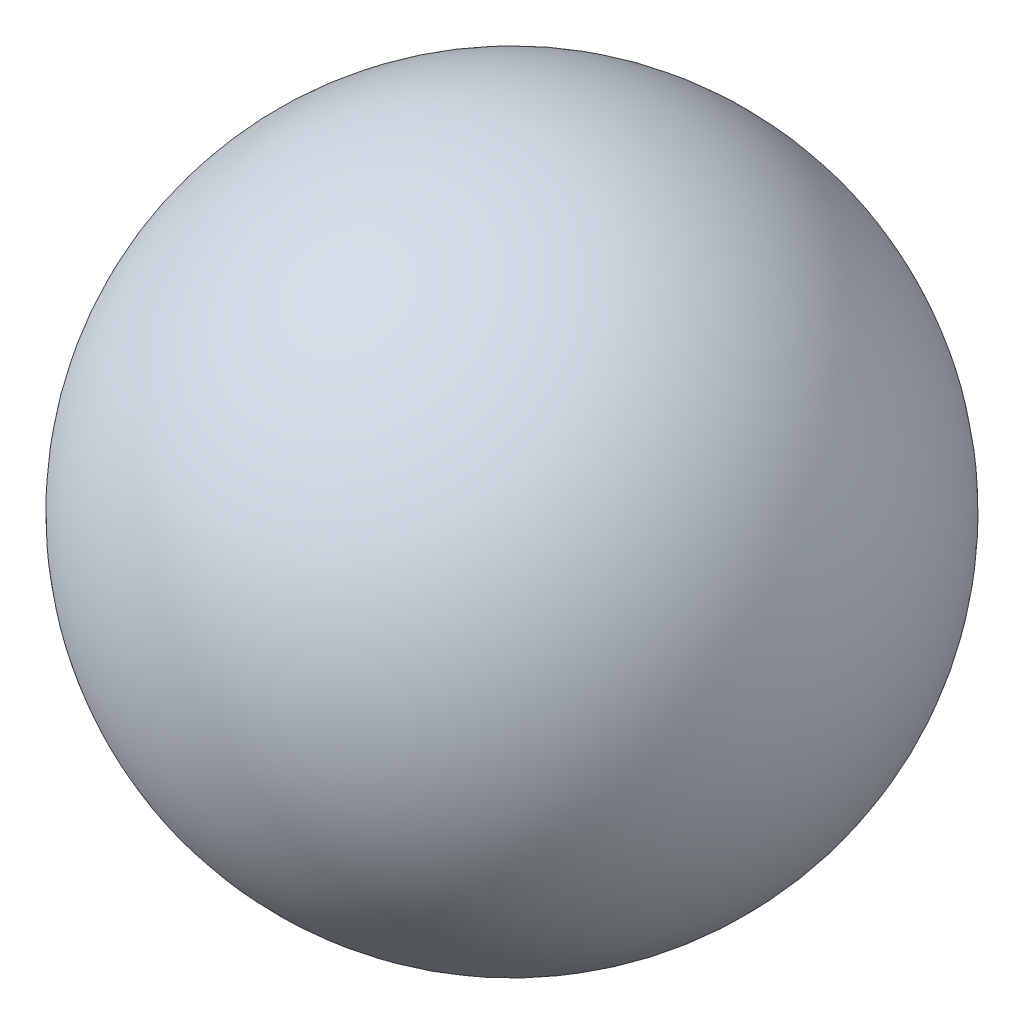
from build123d import *
from build123d.topology import SkipClean


with BuildPart() as part:
    # 草图1 → 旋转1 (revolve)
    with SkipClean():  # the faces are left unmerged after this step: merging them gives an invalid solid
        with BuildSketch(Plane(origin=(0, 0, 0), x_dir=(1, 0, 0), z_dir=(0, 1, 0))):
            with BuildLine():
                ThreePointArc((8, 0), (5.656854249, 5.656854249), (0, 8))
                Line((0, 8), (0, -8))
                ThreePointArc((0, -8), (5.656854249, -5.656854249), (8, 0))
            make_face()
            with BuildLine():
                Line((0, -8), (0, 8))
                ThreePointArc((0, 8), (-8, 0), (0, -8))
            make_face()
        revolve(axis=Axis((0, 0, -8), (0, 0, 1)))


solid = part.part
